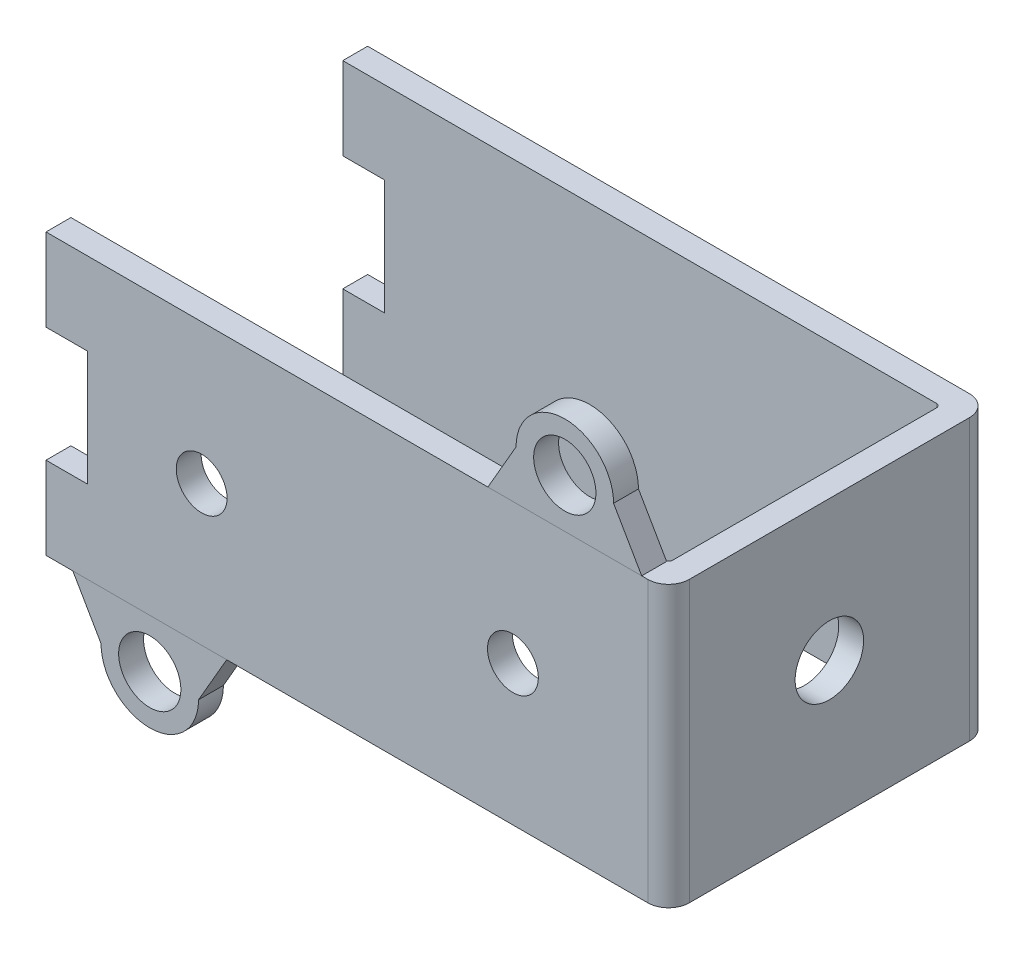
from build123d import *

# Parameters (mm, degrees)
CROQUIS1_W                 = 30
CROQUIS1_H                 = 15.5
SALIENTE_EXTRUIR1_DEPTH    = 6.75
CORTAR_EXTRUIR1_DEPTH      = 19.183096546
CORTAR_EXTRUIR1_DEPTH_BACK = 19.183096546
CROQUIS2_W                 = 28.8
CROQUIS2_H                 = 13.1
CORTAR_EXTRUIR2_REACH      = 33.712
CROQUIS3_R                 = 1.65
REDONDEO1_R                = 1
REDONDEO2_R                = 0.2
CORTAR_EXTRUIR3_DEPTH      = 19.183096546
CORTAR_EXTRUIR3_DEPTH_BACK = 19.183096546
CROQUIS4_W                 = 2
CROQUIS4_H                 = 5.55
CORTAR_EXTRUIR4_REACH      = 24.601
CROQUIS5_R                 = 1.225
SKETCH1_R                  = 2.35
SKETCH1_R_2                = 1.5
BOSS_EXTRUDE2_DEPTH        = 1.2


with BuildPart() as part:
    # Croquis1 → Saliente-Extruir1 (new, symmetric)
    with BuildSketch(Plane(origin=(0, 0, 0), x_dir=(1, 0, 0), z_dir=(0, 1, 0))):
        Rectangle(CROQUIS1_W, CROQUIS1_H)
    extrude(amount=SALIENTE_EXTRUIR1_DEPTH, both=True)

    # Croquis2 → Cortar-Extruir1 (cut, two sides: drawn at the far end of the back side and taken through both)
    with BuildSketch(Plane(origin=(0, 0, 0), x_dir=(1, 0, 0), z_dir=(0, 1, 0)).offset(-CORTAR_EXTRUIR1_DEPTH_BACK)):
        with Locations((-0.6, 0)):
            Rectangle(CROQUIS2_W, CROQUIS2_H)
    extrude(amount=CORTAR_EXTRUIR1_DEPTH + CORTAR_EXTRUIR1_DEPTH_BACK, mode=Mode.SUBTRACT)

    # Croquis3 → Cortar-Extruir2 (cut, up to next)
    with BuildSketch(Plane(origin=(15, 0, 0), x_dir=(0, 0, -1), z_dir=(1, 0, 0)), mode=Mode.PRIVATE) as cortar_extruir2_sk1:
        Circle(CROQUIS3_R)
    cortar_extruir2_tool1 = extrude(cortar_extruir2_sk1.sketch, amount=-CORTAR_EXTRUIR2_REACH, mode=Mode.PRIVATE) & part.part
    add(cortar_extruir2_tool1.solids().sort_by_distance((15, 0, 0))[0], mode=Mode.SUBTRACT)

    # Redondeo1
    redondeo1_edges = [part.edges().sort_by_distance(p)[0] for p in [
        (15, 0, -7.75),
        (15, 0, 7.75),
    ]]
    fillet(redondeo1_edges, radius=REDONDEO1_R)

    # Redondeo2
    redondeo2_edges = [part.edges().sort_by_distance(p)[0] for p in [
        (13.8, 0, -6.55),
        (13.8, 0, 6.55),
    ]]
    fillet(redondeo2_edges, radius=REDONDEO2_R)

    # Croquis4 → Cortar-Extruir3 (cut, two sides: drawn at the far end of the back side and taken through both)
    with BuildSketch(Plane.XY.offset(-CORTAR_EXTRUIR3_DEPTH_BACK)):
        with Locations((-14, 0)):
            Rectangle(CROQUIS4_W, CROQUIS4_H)
    extrude(amount=CORTAR_EXTRUIR3_DEPTH + CORTAR_EXTRUIR3_DEPTH_BACK, mode=Mode.SUBTRACT)

    # Croquis5 → Cortar-Extruir4 (cut, up to next)
    with BuildSketch(Plane.XY.offset(7.75), mode=Mode.PRIVATE) as cortar_extruir4_sk1:
        with Locations((-7.5, 0)):
            Circle(CROQUIS5_R)
    cortar_extruir4_tool1 = extrude(cortar_extruir4_sk1.sketch, amount=-CORTAR_EXTRUIR4_REACH, mode=Mode.PRIVATE) & part.part
    # Croquis5 → Cortar-Extruir4 (cut, up to next)
    with BuildSketch(Plane.XY.offset(7.75), mode=Mode.PRIVATE) as cortar_extruir4_sk2:
        with Locations((7.5, 0)):
            Circle(CROQUIS5_R)
    cortar_extruir4_tool2 = extrude(cortar_extruir4_sk2.sketch, amount=-CORTAR_EXTRUIR4_REACH, mode=Mode.PRIVATE) & part.part
    add(cortar_extruir4_tool1.solids().sort_by_distance((-7.5, 0, 7.75))[0], mode=Mode.SUBTRACT)
    add(cortar_extruir4_tool2.solids().sort_by_distance((7.5, 0, 7.75))[0], mode=Mode.SUBTRACT)


with BuildPart() as body_2:
    # Sketch1 → Boss-Extrude2 (new body)
    # profile 1 of 6: a face of its own
    with BuildSketch(Plane.XY.offset(7.75)):
        with Locations((10, 9.1)):
            Circle(SKETCH1_R)
        with Locations((10, 9.1)):
            Circle(SKETCH1_R_2, mode=Mode.SUBTRACT)
    # profile 2 of 6: a face of its own
    with BuildSketch(Plane.XY.offset(7.75)):
        with BuildLine():
            Line((13.706773133, 6.75), (12.35, 9.1))
            ThreePointArc((12.35, 9.1), (11.661700931, 7.438299059), (9.999999986, 6.75))
            Line((9.999999986, 6.75), (13.706773133, 6.75))
        make_face()
    # profile 3 of 6: a face of its own
    with BuildSketch(Plane.XY.offset(7.75)):
        with BuildLine():
            ThreePointArc((9.999999986, 6.75), (8.338299059, 7.438299069), (7.65, 9.1))
            Line((7.65, 9.1), (6.293226867, 6.75))
            Line((6.293226867, 6.75), (9.999999986, 6.75))
        make_face()
    # profile 4 of 6: a face of its own
    with BuildSketch(Plane.XY.offset(7.75)):
        with BuildLine():
            ThreePointArc((-10, -6.75), (-8.338299064, -7.438299064), (-7.65, -9.1))
            Line((-7.65, -9.1), (-6.293226867, -6.75))
            Line((-6.293226867, -6.75), (-10, -6.75))
        make_face()
    # profile 5 of 6: a face of its own
    with BuildSketch(Plane.XY.offset(7.75)):
        with Locations((-10, -9.1)):
            Circle(SKETCH1_R)
        with Locations((-10, -9.1)):
            Circle(SKETCH1_R_2, mode=Mode.SUBTRACT)
    # profile 6 of 6: a face of its own
    with BuildSketch(Plane.XY.offset(7.75)):
        with BuildLine():
            Line((-13.706773133, -6.75), (-12.35, -9.1))
            ThreePointArc((-12.35, -9.1), (-11.661700936, -7.438299064), (-10, -6.75))
            Line((-10, -6.75), (-13.706773133, -6.75))
        make_face()
    extrude(amount=-BOSS_EXTRUDE2_DEPTH)


solid = Compound([part.part, body_2.part])
